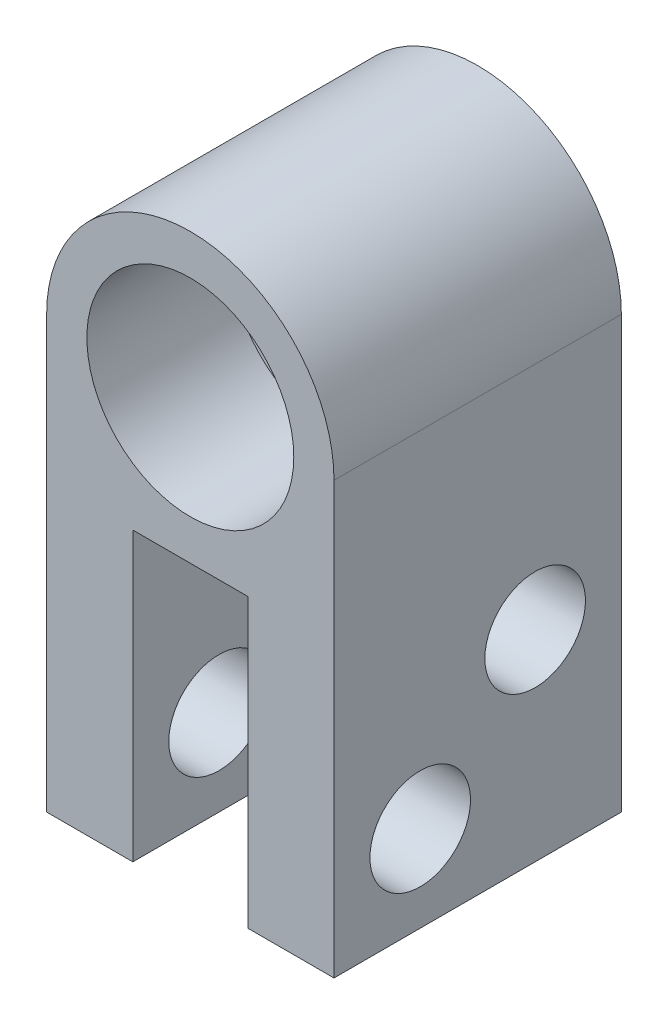
from build123d import *

# Parameters (mm, degrees)
ESBO_O1_R                = 5
ESBO_O1_R_2              = 1.75
RESSALTO_EXTRUS_O1_DEPTH = 10
ESBO_O2_R                = 3.6
CORTE_EXTRUS_O1_DEPTH    = 5
RESSALTO_EXTRUS_O2_START = -10
RESSALTO_EXTRUS_O2_DEPTH = 10
ESBO_O4_R                = 1.75
CORTE_EXTRUS_O2_DEPTH    = 10


with BuildPart() as part:
    # Esboço1 → Ressalto-extrusão1 (new body)
    with BuildSketch(Plane.XY):
        Circle(ESBO_O1_R)
        Circle(ESBO_O1_R_2, mode=Mode.SUBTRACT)
    extrude(amount=RESSALTO_EXTRUS_O1_DEPTH)

    # Esboço2 → Corte-extrusão1 (cut)
    with BuildSketch(Plane.XY.offset(10)):
        Circle(ESBO_O2_R)
    extrude(amount=-CORTE_EXTRUS_O1_DEPTH, mode=Mode.SUBTRACT)

    # Esboço3 → Ressalto-extrusão2 (add)
    with BuildSketch(Plane.XY.offset(10).offset(RESSALTO_EXTRUS_O2_START)):
        with BuildLine():
            Line((2, -4.582575695), (2, -5))
            Line((2, -5), (2, -15))
            Line((2, -15), (5, -15))
            Line((5, -15), (5, 0))
            ThreePointArc((5, 0), (4.183300133, -2.738612788), (2, -4.582575695))
        make_face()
        with BuildLine():
            Line((-2, -15), (-2, -5))
            Line((-2, -5), (-2, -4.582575695))
            ThreePointArc((-2, -4.582575695), (-4.183300133, -2.738612788), (-5, 0))
            Line((-5, 0), (-5, -15))
            Line((-5, -15), (-2, -15))
        make_face()
        with BuildLine():
            Line((-2, -5), (3e-09, -5))
            ThreePointArc((3e-09, -5), (-1.021548217, -4.894531565), (-2, -4.582575695))
            Line((-2, -4.582575695), (-2, -5))
        make_face()
        with BuildLine():
            Line((3e-09, -5), (2, -5))
            Line((2, -5), (2, -4.582575695))
            ThreePointArc((2, -4.582575695), (1.02154822, -4.894531564), (3e-09, -5))
        make_face()
        with BuildLine():
            ThreePointArc((-2, -4.582575695), (-1.021548217, -4.894531565), (3e-09, -5))
            ThreePointArc((3e-09, -5), (1.02154822, -4.894531564), (2, -4.582575695))
            Line((2, -4.582575695), (-2, -4.582575695))
        make_face()
    extrude(amount=RESSALTO_EXTRUS_O2_DEPTH)

    # Esboço4 → Corte-extrusão2 (cut)
    with BuildSketch(Plane.ZY.offset(5)):
        with Locations((7, -12)):
            Circle(ESBO_O4_R)
        with Locations((3, -8)):
            Circle(ESBO_O4_R)
    extrude(amount=-CORTE_EXTRUS_O2_DEPTH, mode=Mode.SUBTRACT)


solid = part.part
